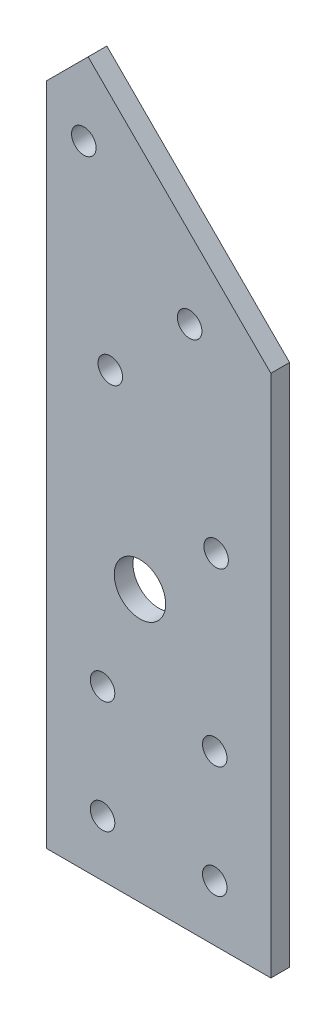
from build123d import *

# Parameters (mm, degrees)
BOSS_EXTRUDE1_DEPTH              = 6.35
F_21_64_0_32813_DIAMETER_HOLE1_D = 8.334502
LPATTERN1_COUNT                  = 2
LPATTERN1_PITCH                  = 38.1
LPATTERN1_COUNT_DIR2             = 2
LPATTERN1_PITCH_DIR2             = 38.1
F_21_64_0_32813_DIAMETER_HOLE2_D = 8.334502
LPATTERN2_COUNT                  = 3
LPATTERN2_PITCH                  = 50.8
LPATTERN2_COUNT_DIR2             = 2
LPATTERN2_PITCH_DIR2             = 38.1
F_11_16_0_6875_DIAMETER_HOLE1_D  = 17.4625


with BuildPart() as part:
    # Sketch1 → Boss-Extrude1 (new body)
    with BuildSketch(Plane.XY):
        Polygon((0, 0), (76.2, 0), (76.2, 177.8), (14.160193237, 239.839806763), (0, 225.679613527), align=None)
    extrude(amount=BOSS_EXTRUDE1_DEPTH)

    # 21/64 (0.32813) Diameter Hole1 (through all)
    with Locations(Plane.XY.offset(6.35)):
        with Locations((57.15, 19.05)):
            f_21_64_0_32813_diameter_hole1 = Hole(F_21_64_0_32813_DIAMETER_HOLE1_D / 2)

    # LPattern1: 21_64 _0.32813_ Diameter Hole1 2 × 2
    with Locations(*[(-i * LPATTERN1_PITCH, j * LPATTERN1_PITCH_DIR2, 0) for i in range(LPATTERN1_COUNT) for j in range(LPATTERN1_COUNT_DIR2) if (i, j) != (0, 0)]):
        add(f_21_64_0_32813_diameter_hole1, mode=Mode.SUBTRACT)

    # 21/64 (0.32813) Diameter Hole2 (through all)
    with Locations(Plane.XY.offset(6.35)):
        with Locations((12.7, 214.359231637)):
            f_21_64_0_32813_diameter_hole2 = Hole(F_21_64_0_32813_DIAMETER_HOLE2_D / 2)

    # LPattern2: 21_64 _0.32813_ Diameter Hole2 3 × 2, 2 skipped
    with Locations(*[Vector(0.7071067811865515, -0.7071067811865437, 0) * (i * LPATTERN2_PITCH) + Vector(-0.7071067811865441, -0.707106781186551, 0) * (j * LPATTERN2_PITCH_DIR2) for i in range(LPATTERN2_COUNT) for j in range(LPATTERN2_COUNT_DIR2) if (i, j) not in ((0, 0), (0, 1), (2, 0))]):
        add(f_21_64_0_32813_diameter_hole2, mode=Mode.SUBTRACT)

    # 11/16 (0.6875) Diameter Hole1 (through all)
    with Locations(Plane.XY.offset(6.35)):
        with Locations((31.75, 92.075)):
            Hole(F_11_16_0_6875_DIAMETER_HOLE1_D / 2)


solid = part.part
